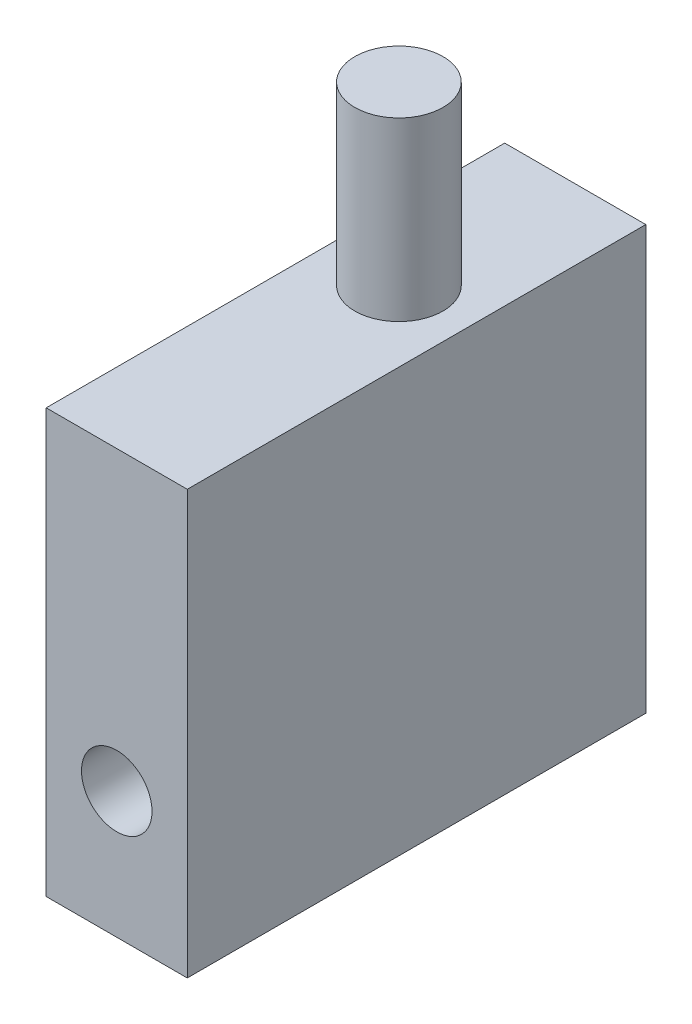
from build123d import *

# Parameters (mm, degrees)
SKETCH_1_W          = 4
SKETCH_1_H          = 12
EXTRUDE_1_DEPTH     = 13
SKETCH_2_R          = 1.25
EXTRUDE_2_DEPTH     = 5
SKETCH_3_R          = 1
CUT_EXTRUDE_1_DEPTH = 22.771541057


with BuildPart() as part:
    # 草图1 → 凸台-拉伸1 (new body)
    with BuildSketch(Plane.XY):
        with Locations((2, 6)):
            Rectangle(SKETCH_1_W, SKETCH_1_H)
    extrude(amount=EXTRUDE_1_DEPTH)

    # 草图2 → 凸台-拉伸2 (add)
    with BuildSketch(Plane(origin=(0, 12, 0), x_dir=(1, 0, 0), z_dir=(0, 1, 0))):
        with Locations(Location((2, -5, 0), (0, 0, 270))):
            Circle(SKETCH_2_R)
    extrude(amount=EXTRUDE_2_DEPTH)

    # 草图3 → 切除-拉伸1 (cut, through all)
    with BuildSketch(Plane.XY.offset(13)):
        with Locations((2, 3.59)):
            Circle(SKETCH_3_R)
    extrude(amount=-CUT_EXTRUDE_1_DEPTH, mode=Mode.SUBTRACT)


solid = part.part
